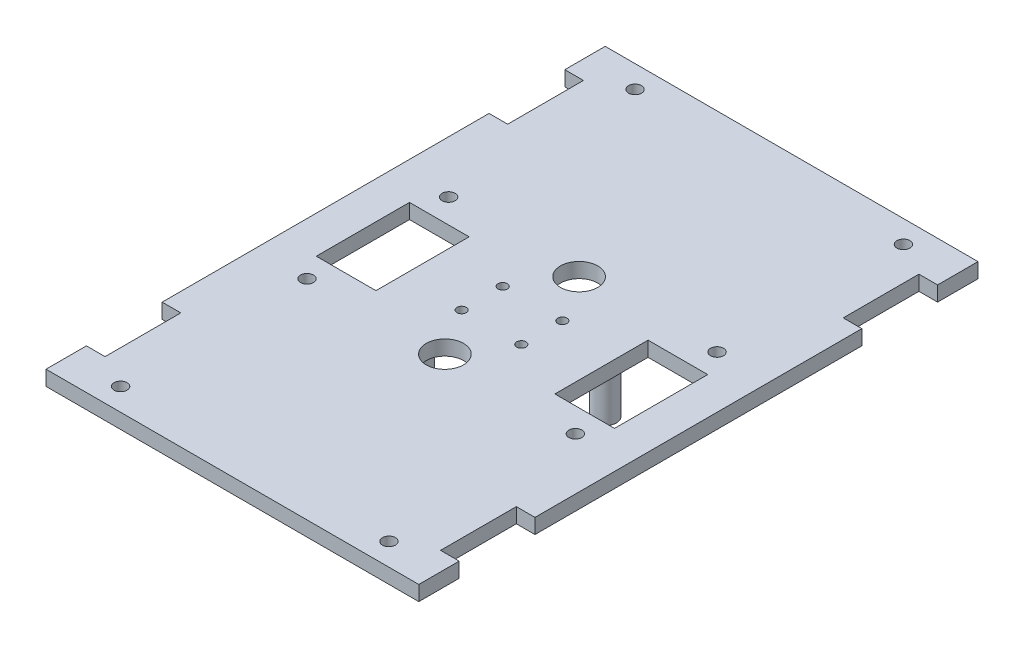
from build123d import *

# Parameters (mm, degrees)
SKETCH_1_W               = 100
SKETCH_1_H               = 150
EXTRUDE_2_DEPTH          = 2
SKETCH_3_R               = 1.75
CUT_EXTRUDE_1_DEPTH      = 91.227490268
MIRROR_2_COPY_1_SKETCH_R = 1.75
MIRROR_2_COPY_1_DEPTH    = 91.227490268
SKETCH_5_W               = 20
SKETCH_5_H               = 15
CUT_EXTRUDE_3_DEPTH      = 1
SKETCH_6_R               = 1.25
CUT_EXTRUDE_4_DEPTH      = 3
SKETCH_8_W               = 16
SKETCH_8_H               = 25
CUT_EXTRUDE_5_DEPTH      = 91.227490268
SKETCH_9_W               = 66
SKETCH_9_H               = 36
CUT_EXTRUDE_7_DEPTH      = 1
SKETCH_10_R              = 1.25
CUT_EXTRUDE_8_DEPTH      = 2
SKETCH_11_W              = 68
SKETCH_11_H              = 55
EXTRUDE_3_DEPTH          = 3
SKETCH_12_R              = 1.5
SKETCH_12_R_2            = 1.25
CUT_EXTRUDE_9_DEPTH      = 3
SKETCH_13_W              = 10
SKETCH_13_H              = 55
SKETCH_13_W_2            = 43
CUT_EXTRUDE_10_DEPTH     = 3
SKETCH_14_W              = 10
SKETCH_14_H              = 42
SKETCH_14_W_2            = 5
SKETCH_14_H_2            = 12.78
SKETCH_14_H_3            = 19.94
SKETCH_14_H_4            = 6.28
CUT_EXTRUDE_11_DEPTH     = 3
SKETCH_15_W              = 5
SKETCH_15_H              = 20.32
CUT_EXTRUDE_12_DEPTH     = 91.227490268
MIRROR_4_COPY_1_SKETCH_W = 5
MIRROR_4_COPY_1_SKETCH_H = 20.32
MIRROR_4_COPY_1_DEPTH    = 91.227490268
SKETCH_17_R              = 3
EXTRUDE_4_DEPTH          = 17
SKETCH_19_R              = 1.5
CUT_EXTRUDE_14_DEPTH     = 3
SKETCH_20_R              = 5
CUT_EXTRUDE_15_DEPTH     = 92.727858364


with BuildPart() as part:
    # 草图1 → 凸台-拉伸2 (new, symmetric)
    with BuildSketch(Plane(origin=(0, 0, 0), x_dir=(1, 0, 0), z_dir=(0, 1, 0))):
        Rectangle(SKETCH_1_W, SKETCH_1_H)
    extrude(amount=EXTRUDE_2_DEPTH, both=True)

    # 草图3 → 切除-拉伸1 (cut, through all)
    with BuildSketch(Plane(origin=(0, 2, 0), x_dir=(1, 0, 0), z_dir=(0, 1, 0))):
        with Locations(Location((-36, -19, 0), (0, 0, 270))):
            Circle(SKETCH_3_R)
        with Locations(Location((-36, -69, 0), (0, 0, 270))):
            Circle(SKETCH_3_R)
    cut_extrude_1 = extrude(amount=-CUT_EXTRUDE_1_DEPTH, mode=Mode.SUBTRACT)

    # 镜向1: 切除-拉伸1 across plane
    add(cut_extrude_1.mirror(Plane(origin=(0, 0, 0), x_dir=(0, 0, 1), z_dir=(1, 0, 0))), mode=Mode.SUBTRACT)

    # 镜向2: 切除-拉伸1 across plane
    add(cut_extrude_1.mirror(Plane.XY), mode=Mode.SUBTRACT)

    # 镜向2 copy 1 sketch → 镜向2 copy 1 (cut, through all)
    with BuildSketch(Plane(origin=(0, 2, 0), x_dir=(-1, 0, 0), z_dir=(0, 1, 0))):
        with Locations(Location((-36, -19, 0), (0, 0, 270))):
            Circle(MIRROR_2_COPY_1_SKETCH_R)
        with Locations(Location((-36, -69, 0), (0, 0, 270))):
            Circle(MIRROR_2_COPY_1_SKETCH_R)
    extrude(amount=-MIRROR_2_COPY_1_DEPTH, mode=Mode.SUBTRACT)

    # 草图5 → 切除-拉伸3 (cut)
    with BuildSketch(Plane.XZ.offset(2)):
        Rectangle(SKETCH_5_W, SKETCH_5_H)
    extrude(amount=-CUT_EXTRUDE_3_DEPTH, mode=Mode.SUBTRACT)

    # 草图6 → 切除-拉伸4 (cut)
    with BuildSketch(Plane.XZ.offset(1)):
        with Locations(Location((-8, 5.5, 0), (0, 0, 270))):
            Circle(SKETCH_6_R)
        with Locations(Location((8, 5.5, 0), (0, 0, 90))):
            Circle(SKETCH_6_R)
        with Locations(Location((8, -5.5, 0), (0, 0, 270))):
            Circle(SKETCH_6_R)
        with Locations(Location((-8, -5.5, 0), (0, 0, 90))):
            Circle(SKETCH_6_R)
    extrude(amount=-CUT_EXTRUDE_4_DEPTH, mode=Mode.SUBTRACT)

    # 草图8 → 切除-拉伸5 (cut, through all)
    with BuildSketch(Plane(origin=(0, 2, 0), x_dir=(1, 0, 0), z_dir=(0, 1, 0))):
        with Locations((-32, 0)):
            Rectangle(SKETCH_8_W, SKETCH_8_H)
        with Locations((32, 0)):
            Rectangle(SKETCH_8_W, SKETCH_8_H)
    extrude(amount=-CUT_EXTRUDE_5_DEPTH, mode=Mode.SUBTRACT)

    # 草图9 → 切除-拉伸7 (cut)
    with BuildSketch(Plane.XZ.offset(2)):
        with Locations((0, 45)):
            Rectangle(SKETCH_9_W, SKETCH_9_H)
    extrude(amount=-CUT_EXTRUDE_7_DEPTH, mode=Mode.SUBTRACT)

    # 草图10 → 切除-拉伸8 (cut)
    with BuildSketch(Plane.XZ.offset(1)):
        with Locations(Location((-30.48, 60.55, 0), (0, 0, 270))):
            Circle(SKETCH_10_R)
        with Locations(Location((30.48, 60.55, 0), (0, 0, 90))):
            Circle(SKETCH_10_R)
        with Locations(Location((30.48, 29.45, 0), (0, 0, 270))):
            Circle(SKETCH_10_R)
        with Locations(Location((-30.48, 29.45, 0), (0, 0, 90))):
            Circle(SKETCH_10_R)
    extrude(amount=-CUT_EXTRUDE_8_DEPTH, mode=Mode.SUBTRACT)

    # 草图11 → 凸台-拉伸3 (add)
    with BuildSketch(Plane.XZ.offset(2)):
        with Locations((0, -42.5)):
            Rectangle(SKETCH_11_W, SKETCH_11_H)
    extrude(amount=EXTRUDE_3_DEPTH)

    # 草图12 → 切除-拉伸9 (cut)
    with BuildSketch(Plane.XZ.offset(5)):
        with Locations(Location((-18.76, -17.54, 0), (0, 0, 270))):
            Circle(SKETCH_12_R)
        with Locations(Location((-18.76, -65.8, 0), (0, 0, 270))):
            Circle(SKETCH_12_R)
        with Locations(Location((32.04, -32.78, 0), (0, 0, 270))):
            Circle(SKETCH_12_R_2)
        with Locations(Location((32.04, -60.72, 0), (0, 0, 270))):
            Circle(SKETCH_12_R)
    extrude(amount=-CUT_EXTRUDE_9_DEPTH, mode=Mode.SUBTRACT)

    # 草图13 → 切除-拉伸10 (cut)
    with BuildSketch(Plane.XZ.offset(5)):
        with Locations((-29, -42.5)):
            Rectangle(SKETCH_13_W, SKETCH_13_H)
        with Locations((7.5, -42.5)):
            Rectangle(SKETCH_13_W_2, SKETCH_13_H)
    extrude(amount=-CUT_EXTRUDE_10_DEPTH, mode=Mode.SUBTRACT)

    # 草图14 → 切除-拉伸11 (cut)
    with BuildSketch(Plane.XZ.offset(5)):
        with Locations((-19, -41.742030173)):
            Rectangle(SKETCH_14_W, SKETCH_14_H)
        with Locations((31.5, -21.39)):
            Rectangle(SKETCH_14_W_2, SKETCH_14_H_2)
        with Locations((31.5, -47.75)):
            Rectangle(SKETCH_14_W_2, SKETCH_14_H_3)
        with Locations((31.5, -66.86)):
            Rectangle(SKETCH_14_W_2, SKETCH_14_H_4)
    extrude(amount=-CUT_EXTRUDE_11_DEPTH, mode=Mode.SUBTRACT)

    # 草图15 → 切除-拉伸12 (cut, through all)
    with BuildSketch(Plane.XZ.offset(2)):
        with Locations((-47.5, -54)):
            Rectangle(SKETCH_15_W, SKETCH_15_H)
    cut_extrude_12 = extrude(amount=-CUT_EXTRUDE_12_DEPTH, mode=Mode.SUBTRACT)

    # 镜向3: 切除-拉伸12 across plane
    add(cut_extrude_12.mirror(Plane.XY), mode=Mode.SUBTRACT)

    # 镜向4: 切除-拉伸12 across plane
    add(cut_extrude_12.mirror(Plane(origin=(0, 0, 0), x_dir=(0, 0, 1), z_dir=(1, 0, 0))), mode=Mode.SUBTRACT)

    # 镜向4 copy 1 sketch → 镜向4 copy 1 (cut, through all)
    with BuildSketch(Plane(origin=(0, -2, 0), x_dir=(-1, 0, 0), z_dir=(0, -1, 0))):
        with Locations((-47.5, -54)):
            Rectangle(MIRROR_4_COPY_1_SKETCH_W, MIRROR_4_COPY_1_SKETCH_H)
    extrude(amount=-MIRROR_4_COPY_1_DEPTH, mode=Mode.SUBTRACT)

    # 草图17 → 凸台-拉伸4 (add)
    with BuildSketch(Plane.XZ.offset(2)):
        with Locations(Location((15, 10, 0), (0, 0, 270))):
            Circle(SKETCH_17_R)
        with Locations(Location((-15, 10, 0), (0, 0, 90))):
            Circle(SKETCH_17_R)
        with Locations(Location((15, -10, 0), (0, 0, 90))):
            Circle(SKETCH_17_R)
        with Locations(Location((-15, -10, 0), (0, 0, 270))):
            Circle(SKETCH_17_R)
    extrude(amount=EXTRUDE_4_DEPTH)

    # 草图19 → 切除-拉伸14 (cut)
    with BuildSketch(Plane.XZ.offset(19)):
        with Locations(Location((15, 10, 0), (0, 0, 270))):
            Circle(SKETCH_19_R)
        with Locations(Location((-15, 10, 0), (0, 0, 90))):
            Circle(SKETCH_19_R)
        with Locations(Location((15, -10, 0), (0, 0, 90))):
            Circle(SKETCH_19_R)
        with Locations(Location((-15, -10, 0), (0, 0, 270))):
            Circle(SKETCH_19_R)
    extrude(amount=-CUT_EXTRUDE_14_DEPTH, mode=Mode.SUBTRACT)

    # 草图20 → 切除-拉伸15 (cut, through all)
    with BuildSketch(Plane.XZ.offset(2)):
        with Locations(Location((0, 18, 0), (0, 0, 270))):
            Circle(SKETCH_20_R)
        with Locations(Location((0, -18, 0), (0, 0, 90))):
            Circle(SKETCH_20_R)
    extrude(amount=-CUT_EXTRUDE_15_DEPTH, mode=Mode.SUBTRACT)


solid = part.part
